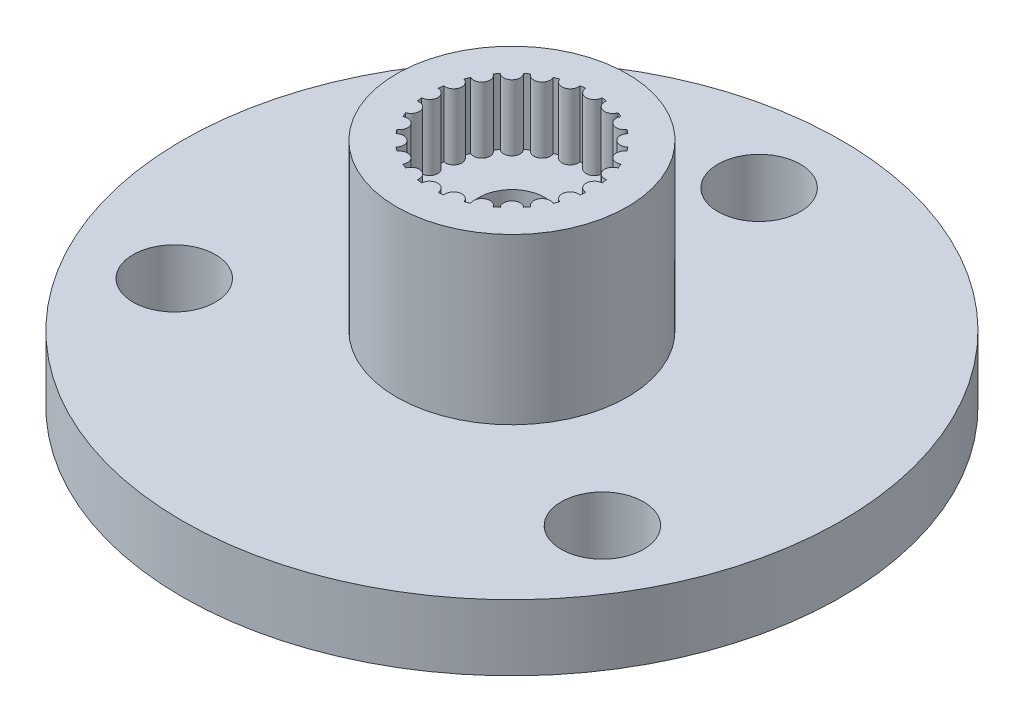
from build123d import *

# Parameters (mm, degrees)
SKETCH1_R           = 10
SKETCH1_R_2         = 1
BOSS_EXTRUDE1_DEPTH = 2
SKETCH2_R           = 3.5
SKETCH2_R_2         = 2.5
BOSS_EXTRUDE2_DEPTH = 5
CUT_EXTRUDE1_REACH  = 17
SKETCH3_R           = 1.25
CIRPATTERN1_COUNT   = 3
SKETCH4_R           = 2.5
SKETCH4_R_2         = 1
BOSS_EXTRUDE3_DEPTH = 3
SKETCH5_R           = 2
CUT_EXTRUDE2_DEPTH  = 4
BOSS_EXTRUDE4_START = -2
BOSS_EXTRUDE4_DEPTH = 2
CIRPATTERN2_COUNT   = 24


with BuildPart() as part:
    # Sketch1 → Boss-Extrude1 (new body)
    with BuildSketch(Plane(origin=(0, 0, 0), x_dir=(1, 0, 0), z_dir=(0, 1, 0))):
        with Locations(Location((0, 0, 0), (0, 0, 270))):
            Circle(SKETCH1_R)
        with Locations(Location((0, 0, 0), (0, 0, 270))):
            Circle(SKETCH1_R_2, mode=Mode.SUBTRACT)
    extrude(amount=BOSS_EXTRUDE1_DEPTH)

    # Sketch2 → Boss-Extrude2 (add)
    with BuildSketch(Plane(origin=(0, 2, 0), x_dir=(1, 0, 0), z_dir=(0, 1, 0))):
        with Locations(Location((0, 0, 0), (0, 0, 270))):
            Circle(SKETCH2_R)
        with Locations(Location((0, 0, 0), (0, 0, 270))):
            Circle(SKETCH2_R_2, mode=Mode.SUBTRACT)
    extrude(amount=BOSS_EXTRUDE2_DEPTH)

    # Sketch3 → Cut-Extrude1 (cut, up to next)
    with BuildSketch(Plane(origin=(0, 2, 0), x_dir=(1, 0, 0), z_dir=(0, 1, 0)), mode=Mode.PRIVATE) as cut_extrude1_sk1:
        with Locations(Location((0, 7.5, 0), (0, 0, 270))):
            Circle(SKETCH3_R)
    cut_extrude1_tool1 = extrude(cut_extrude1_sk1.sketch, amount=-CUT_EXTRUDE1_REACH, mode=Mode.PRIVATE) & part.part
    cut_extrude1 = cut_extrude1_tool1.solids().sort_by_distance((0, 2, -7.5))[0]
    add(cut_extrude1, mode=Mode.SUBTRACT)

    # CirPattern1: Cut-Extrude1 ×3 about axis
    cirpattern1_axis = Axis((0, 0, 0), (0, 1, 0))
    for i in range(1, CIRPATTERN1_COUNT):
        add(cut_extrude1.rotate(cirpattern1_axis, i * 360 / CIRPATTERN1_COUNT), mode=Mode.SUBTRACT)

    # Sketch4 → Boss-Extrude3 (add)
    with BuildSketch(Plane(origin=(0, 2, 0), x_dir=(1, 0, 0), z_dir=(0, 1, 0))):
        with Locations(Location((0, 0, 0), (0, 0, 270))):
            Circle(SKETCH4_R)
        with Locations(Location((0, 0, 0), (0, 0, 270))):
            Circle(SKETCH4_R_2, mode=Mode.SUBTRACT)
    extrude(amount=BOSS_EXTRUDE3_DEPTH)

    # Sketch5 → Cut-Extrude2 (cut)
    with BuildSketch(Plane.XZ):
        with Locations(Location((0, 0, 0), (0, 0, 270))):
            Circle(SKETCH5_R)
    extrude(amount=-CUT_EXTRUDE2_DEPTH, mode=Mode.SUBTRACT)

    # Sketch6 → Boss-Extrude4 (add)
    with BuildSketch(Plane(origin=(0, 7, 0), x_dir=(1, 0, 0), z_dir=(0, 1, 0)).offset(BOSS_EXTRUDE4_START)):
        with BuildLine():
            ThreePointArc((-0.249687304, 2.4875), (0, 2.25), (0.249687304, 2.4875))
            ThreePointArc((0.249687304, 2.4875), (0, 2.5), (-0.249687304, 2.4875))
        make_face()
    boss_extrude4 = extrude(amount=BOSS_EXTRUDE4_DEPTH)

    # CirPattern2: Boss-Extrude4 ×24 about axis
    cirpattern2_axis = Axis((0, 0, 0), (0, 1, 0))
    for i in range(1, CIRPATTERN2_COUNT):
        add(boss_extrude4.rotate(cirpattern2_axis, i * 360 / CIRPATTERN2_COUNT))


solid = part.part
